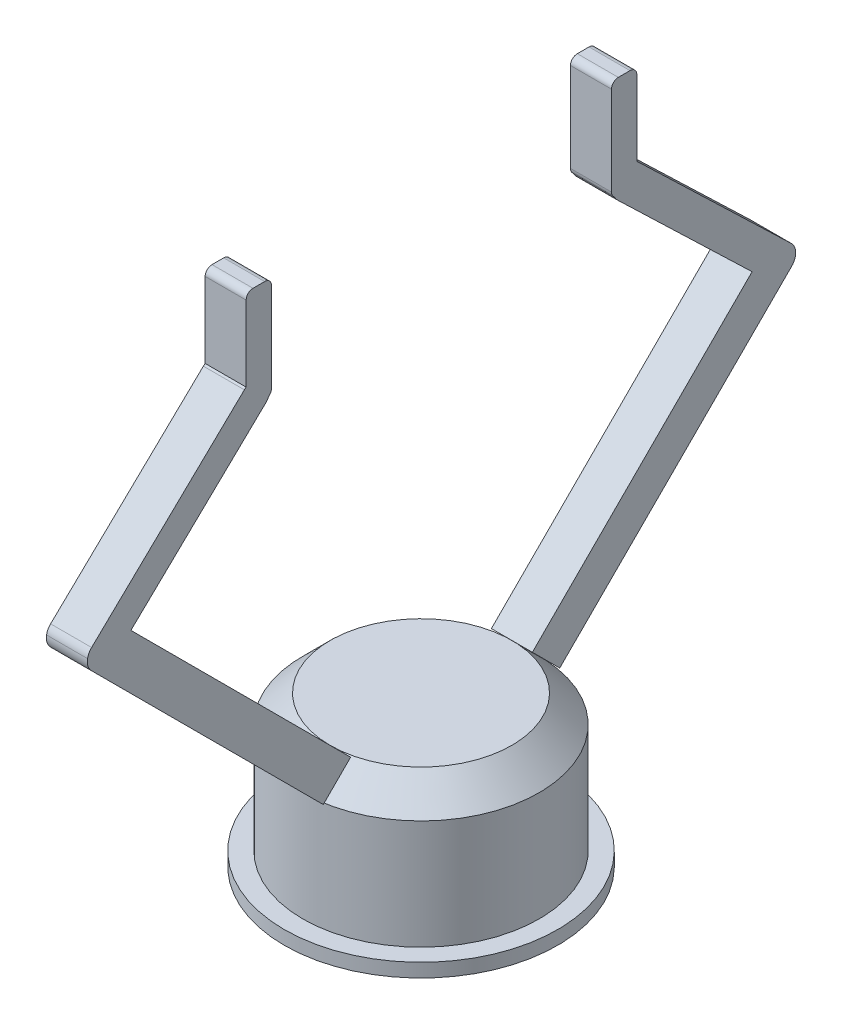
from build123d import *

# Parameters (mm, degrees)
SKETCH2_R                = 100
BOSS_EXTRUDE1_DEPTH      = 10
SKETCH3_R                = 86.498143994
BOSS_EXTRUDE2_DEPTH      = 100
CHAMFER1_SIZE            = 20
BOSS_EXTRUDE3_DEPTH      = 15
BOSS_EXTRUDE3_DEPTH_BACK = 15
BOSS_EXTRUDE4_DEPTH      = 15
BOSS_EXTRUDE4_DEPTH_BACK = 15
BOSS_EXTRUDE5_DEPTH      = 15
BOSS_EXTRUDE5_DEPTH_BACK = 15


with BuildPart() as part:
    # Sketch2 → Boss-Extrude1 (new body)
    with BuildSketch(Plane(origin=(0, 0, 0), x_dir=(1, 0, 0), z_dir=(0, 1, 0))):
        Circle(SKETCH2_R)
    extrude(amount=BOSS_EXTRUDE1_DEPTH)

    # Sketch3 → Boss-Extrude2 (add)
    with BuildSketch(Plane(origin=(0, 10, 0), x_dir=(1, 0, 0), z_dir=(0, 1, 0))):
        Circle(SKETCH3_R)
    extrude(amount=BOSS_EXTRUDE2_DEPTH)

    # Chamfer1
    chamfer1_edges = [part.edges().sort_by_distance(p)[0] for p in [
        (-86.498143994, 110, 0),
    ]]
    chamfer(chamfer1_edges, length=CHAMFER1_SIZE)


with BuildPart() as body_2:
    # Sketch4 → Boss-Extrude3 (new, two sides: drawn at the far end of the back side and taken through both)
    with BuildSketch(Plane(origin=(0, 0, 0), x_dir=(0, 0, -1), z_dir=(1, 0, 0)).offset(-BOSS_EXTRUDE3_DEPTH_BACK)):
        with BuildLine():
            Line((-66.498143994, 110), (-86.498143994, 90))
            Line((-86.498143994, 90), (-256.203771479, 259.705627485))
            ThreePointArc((-256.203771479, 259.705627485), (-259.132703667, 266.776695297), (-256.203771479, 273.847763109))
            Line((-256.203771479, 273.847763109), (-250.345907103, 279.705627485))
            ThreePointArc((-250.345907103, 279.705627485), (-243.274839291, 282.634559673), (-236.203771479, 279.705627485))
            Line((-236.203771479, 279.705627485), (-66.498143994, 110))
        make_face()
    extrude(amount=BOSS_EXTRUDE3_DEPTH + BOSS_EXTRUDE3_DEPTH_BACK)

    # Sketch5 → Boss-Extrude4 (add, two sides: drawn at the far end of the back side and taken through both)
    with BuildSketch(Plane(origin=(0, 0, 0), x_dir=(0, 0, -1), z_dir=(1, 0, 0)).offset(-BOSS_EXTRUDE4_DEPTH_BACK)):
        with BuildLine():
            Line((-254.594745219, 258.358125178), (-256.294499809, 260.127425653))
            ThreePointArc((-256.294499809, 260.127425653), (-259.081114839, 267.25577893), (-256.011042283, 274.266720255))
            Line((-256.011042283, 274.266720255), (-144.234713298, 381.649457594))
            ThreePointArc((-144.234713298, 381.649457594), (-137.106360022, 384.436072625), (-130.095418696, 381.366000069))
            Line((-130.095418696, 381.366000069), (-128.395664107, 379.596699593))
            ThreePointArc((-128.395664107, 379.596699593), (-125.609049076, 372.468346317), (-128.679121632, 365.457404992))
            Line((-128.679121632, 365.457404992), (-240.455450617, 258.074667652))
            ThreePointArc((-240.455450617, 258.074667652), (-247.583803894, 255.288052622), (-254.594745219, 258.358125178))
        make_face()
    extrude(amount=BOSS_EXTRUDE4_DEPTH + BOSS_EXTRUDE4_DEPTH_BACK)

    # Sketch7 → Boss-Extrude5 (add, two sides: drawn at the far end of the back side and taken through both)
    with BuildSketch(Plane(origin=(0, 0, 0), x_dir=(0, 0, -1), z_dir=(1, 0, 0)).offset(-BOSS_EXTRUDE5_DEPTH_BACK)):
        with BuildLine():
            Line((-129.373692, 367.640594563), (-137.921663821, 367.640594563))
            ThreePointArc((-137.921663821, 367.640594563), (-141.457197727, 369.105060657), (-142.921663821, 372.640594563))
            Line((-142.921663821, 372.640594563), (-142.921663821, 437.851601178))
            ThreePointArc((-142.921663821, 437.851601178), (-141.457197727, 441.387135084), (-137.921663821, 442.851601178))
            Line((-137.921663821, 442.851601178), (-129.373692, 442.851601178))
            ThreePointArc((-129.373692, 442.851601178), (-125.838158094, 441.387135084), (-124.373692, 437.851601178))
            Line((-124.373692, 437.851601178), (-124.373692, 372.640594563))
            ThreePointArc((-124.373692, 372.640594563), (-125.838158094, 369.105060657), (-129.373692, 367.640594563))
        make_face()
    extrude(amount=BOSS_EXTRUDE5_DEPTH + BOSS_EXTRUDE5_DEPTH_BACK)


with BuildPart() as body_3:
    # Mirror6: mirrored copy
    add(body_2.part.mirror(Plane.XY))


solid = Compound([part.part, body_2.part, body_3.part])
